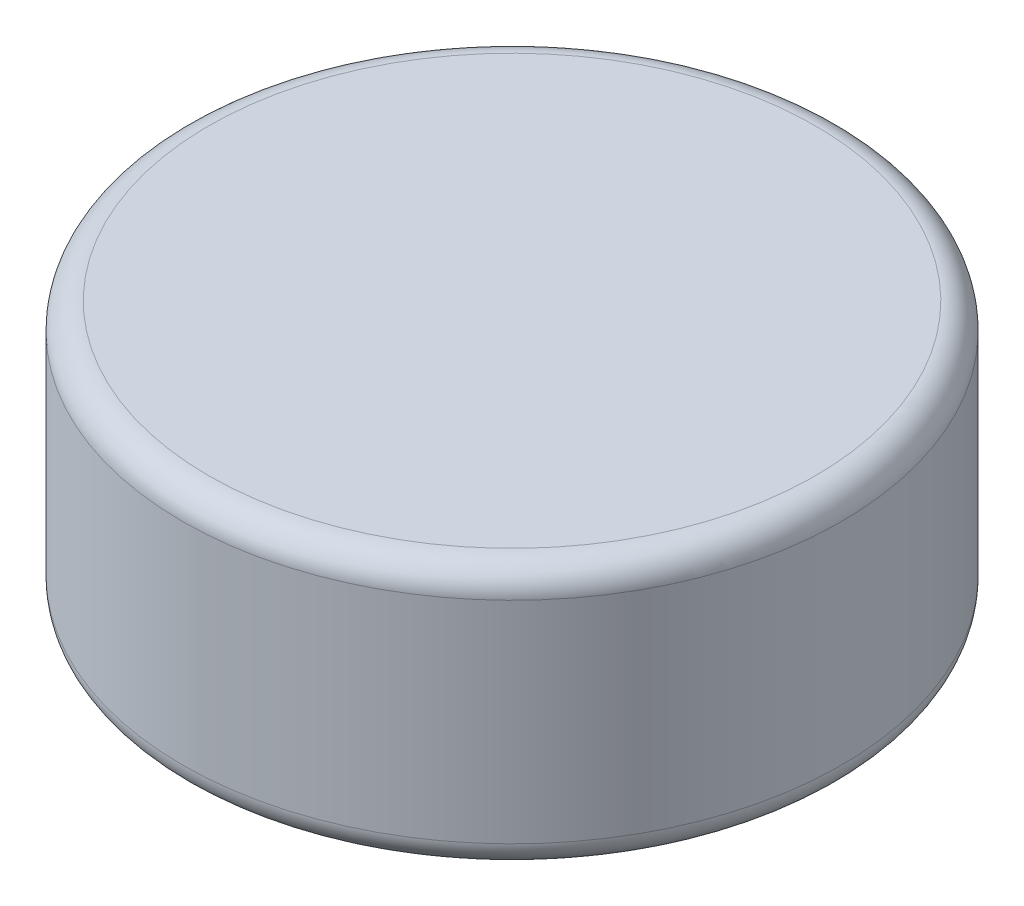
from build123d import *

# Parameters (mm, degrees)
SKETCH1_R           = 2.5
BOSS_EXTRUDE1_DEPTH = 1
FILLET1_R           = 0.2


with BuildPart() as part:
    # Sketch1 → Boss-Extrude1 (new, symmetric)
    with BuildSketch(Plane(origin=(0, 0, 0), x_dir=(1, 0, 0), z_dir=(0, 1, 0))):
        with Locations(Location((0, 0, 0), (0, 0, 270))):
            Circle(SKETCH1_R)
    extrude(amount=BOSS_EXTRUDE1_DEPTH, both=True)

    # Fillet1
    fillet1_edges = [part.edges().sort_by_distance(p)[0] for p in [
        (0, -1, -2.5),
        (0, 1, -2.5),
    ]]
    fillet(fillet1_edges, radius=FILLET1_R)


solid = part.part
